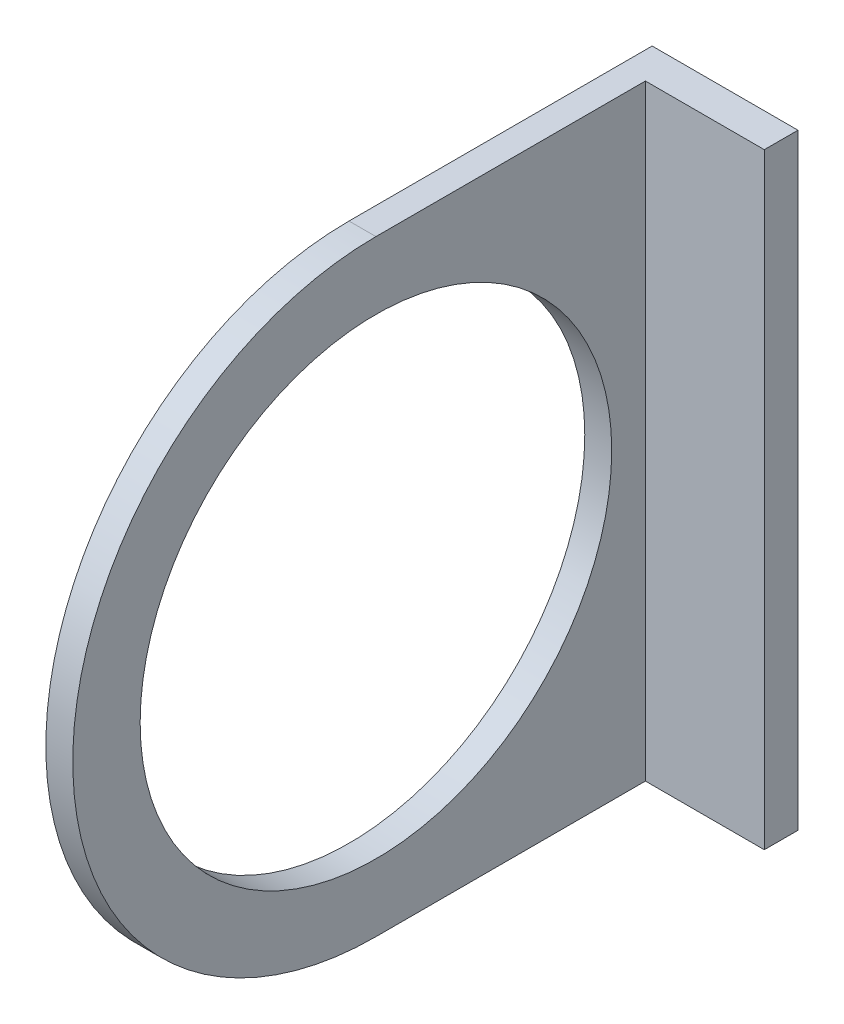
from build123d import *

# Parameters (mm, degrees)
EXTRUDE_1_DEPTH     = 180
SKETCH_2_R          = 70
CUT_EXTRUDE_1_DEPTH = 180


with BuildPart() as part:
    # 草图1 → 凸台-拉伸1 (new body)
    with BuildSketch(Plane(origin=(0, 0, 0), x_dir=(1, 0, 0), z_dir=(0, 1, 0))):
        Polygon((0, 0), (43.3, 0), (43.3, -10), (8, -10), (8, -300), (0, -300), align=None)
    extrude(amount=EXTRUDE_1_DEPTH)

    # 草图2 → 切除-拉伸1 (cut)
    with BuildSketch(Plane(origin=(8, 0, 0), x_dir=(0, 0, -1), z_dir=(1, 0, 0))):
        with Locations((-90, 90)):
            Circle(SKETCH_2_R)
        with BuildLine():
            Line((-90, 0), (-300, 0))
            Line((-300, 0), (-300, 180))
            Line((-300, 180), (-90, 180))
            ThreePointArc((-90, 180), (-180, 90), (-90, 0))
        make_face()
    extrude(amount=-CUT_EXTRUDE_1_DEPTH, mode=Mode.SUBTRACT)


solid = part.part
